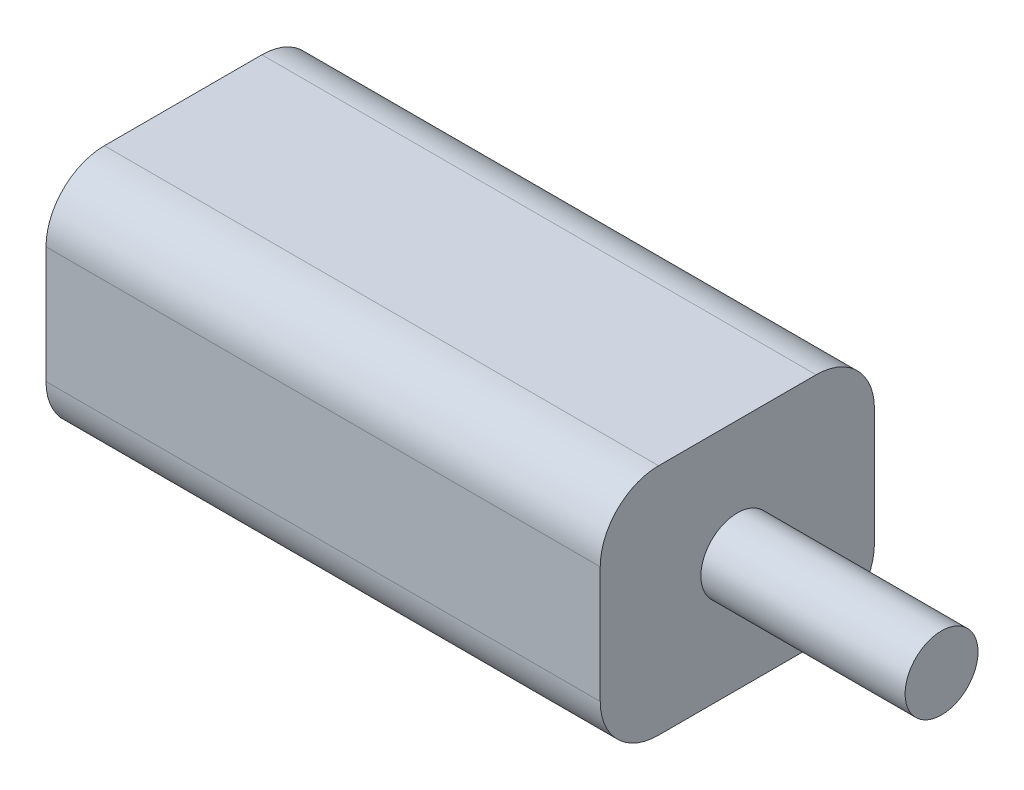
from build123d import *

# Parameters (mm, degrees)
SKETCH1_W           = 11.938
SKETCH1_H           = 10.16
BOSS_EXTRUDE1_DEPTH = 24.13
SKETCH2_R           = 1.5875
BOSS_EXTRUDE2_DEPTH = 8.89
FILLET1_R           = 2.54


with BuildPart() as part:
    # Sketch1 → Boss-Extrude1 (new body)
    with BuildSketch(Plane(origin=(0, 0, 0), x_dir=(0, 0, -1), z_dir=(1, 0, 0))):
        Rectangle(SKETCH1_W, SKETCH1_H)
    extrude(amount=BOSS_EXTRUDE1_DEPTH)

    # Sketch2 → Boss-Extrude2 (add)
    with BuildSketch(Plane(origin=(24.13, 0, 0), x_dir=(0, 0, -1), z_dir=(1, 0, 0))):
        with Locations(Location((0, 0, 0), (0, 0, 180))):
            Circle(SKETCH2_R)
    extrude(amount=BOSS_EXTRUDE2_DEPTH)

    # Fillet1
    fillet1_edges = [part.edges().sort_by_distance(p)[0] for p in [
        (12.065, 5.08, 5.969),
        (12.065, -5.08, 5.969),
        (12.065, -5.08, -5.969),
        (12.065, 5.08, -5.969),
    ]]
    fillet(fillet1_edges, radius=FILLET1_R)


solid = part.part
